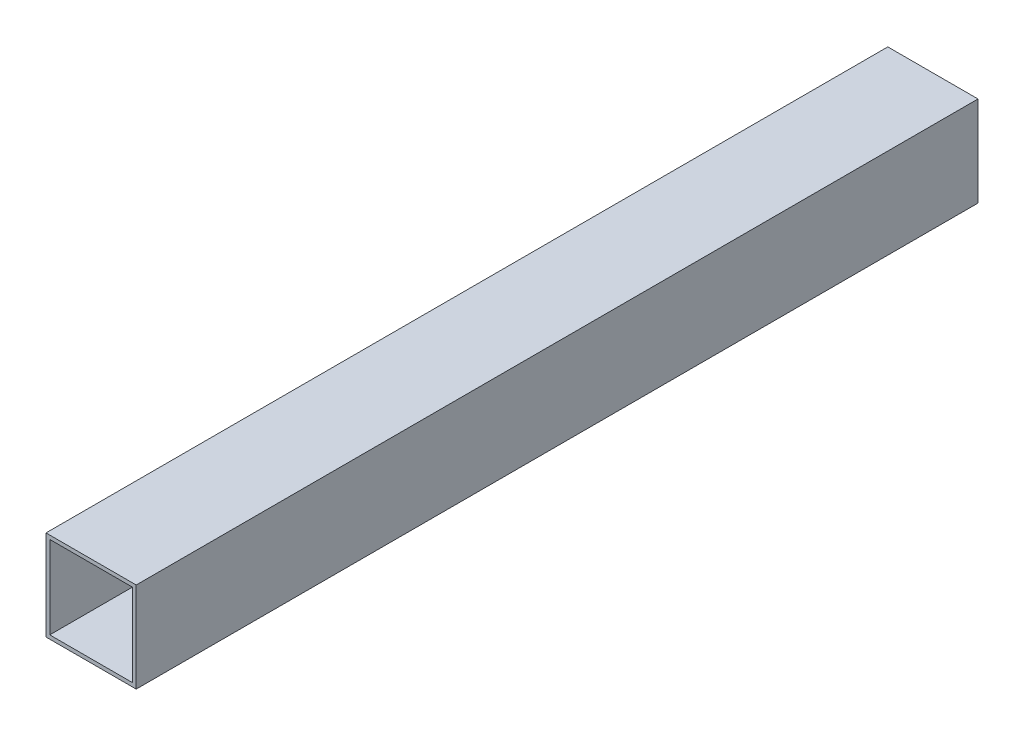
from build123d import *

# Parameters (mm, degrees)
SKETCH2_W           = 76.2
SKETCH2_H           = 76.2
BOSS_EXTRUDE1_DEPTH = 711.2
SKETCH3_W           = 69.85
SKETCH3_H           = 69.85
CUT_EXTRUDE1_DEPTH  = 711.2


with BuildPart() as part:
    # Sketch2 → Boss-Extrude1 (new body)
    with BuildSketch(Plane.XY):
        with Locations((-2.629709588, -19.469024582)):
            Rectangle(SKETCH2_W, SKETCH2_H)
    extrude(amount=BOSS_EXTRUDE1_DEPTH)

    # Sketch3 → Cut-Extrude1 (cut)
    with BuildSketch(Plane.XY.offset(711.2)):
        with Locations((-2.629709588, -19.469024582)):
            Rectangle(SKETCH3_W, SKETCH3_H)
    extrude(amount=-CUT_EXTRUDE1_DEPTH, mode=Mode.SUBTRACT)


solid = part.part
